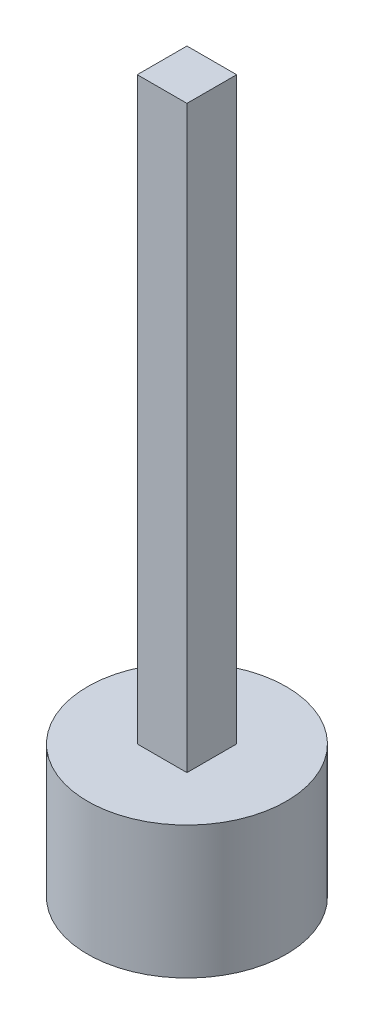
from build123d import *

# Parameters (mm, degrees)
SKETCH1_W           = 30
SKETCH1_H           = 30
BOSS_EXTRUDE1_DEPTH = 350
SKETCH2_R           = 60
BOSS_EXTRUDE2_DEPTH = 80


with BuildPart() as part:
    # Sketch1 → Boss-Extrude1 (new body)
    with BuildSketch(Plane(origin=(0, 0, 0), x_dir=(1, 0, 0), z_dir=(0, 1, 0))):
        with Locations((0, 15)):
            Rectangle(SKETCH1_W, SKETCH1_H)
    extrude(amount=-BOSS_EXTRUDE1_DEPTH)

    # Sketch2 → Boss-Extrude2 (add)
    with BuildSketch(Plane.XZ.offset(350)):
        with Locations(Location((0, -15, 0), (0, 0, 270))):
            Circle(SKETCH2_R)
    extrude(amount=BOSS_EXTRUDE2_DEPTH)


solid = part.part
